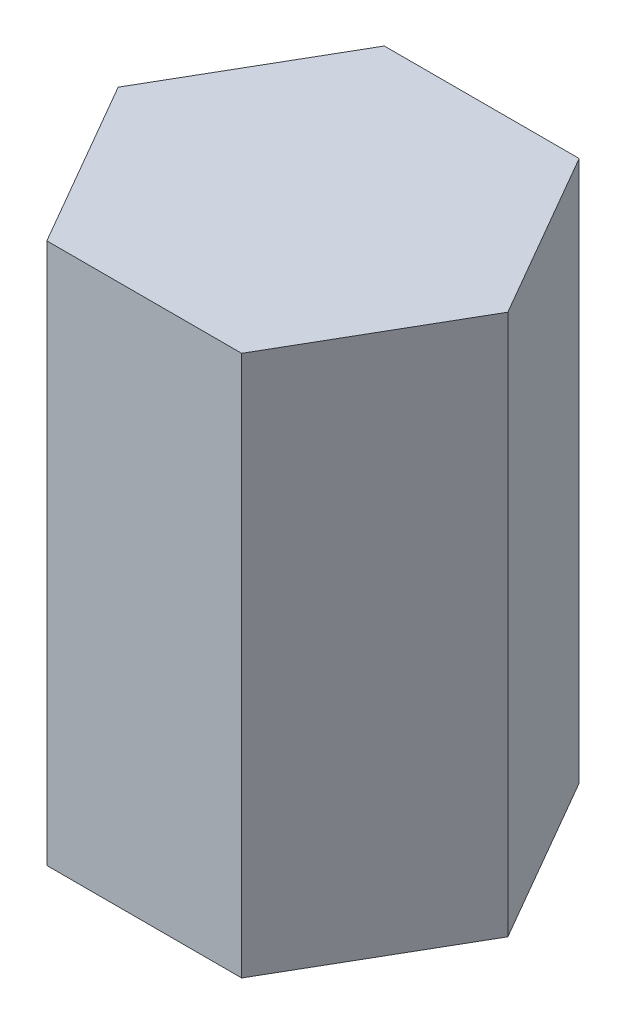
from build123d import *

# Parameters (mm, degrees)
BOSS_EXTRUDE1_DEPTH = 1603
CUT_EXTRUDE1_DEPTH  = 1187.25


with BuildPart() as part:
    # Sketch2 → Boss-Extrude1 (new body)
    with BuildSketch(Plane(origin=(0, 0, 0), x_dir=(1, 0, 0), z_dir=(0, 1, 0))):
        Polygon((577.35026919, 0), (288.675134595, 500), (-288.675134595, 500), (-577.35026919, 0), (-288.675134595, -500), (288.675134595, -500), align=None)
    extrude(amount=BOSS_EXTRUDE1_DEPTH)

    # Sketch3 → Cut-Extrude1 (cut)
    with BuildSketch(Plane(origin=(0, 400.75, 0), x_dir=(1, 0, 0), z_dir=(0, 1, 0))):
        Polygon((575.040868113, 0), (287.520434056, 498), (-287.520434056, 498), (-575.040868113, 0), (-287.520434056, -498), (287.520434056, -498), align=None)
    extrude(amount=CUT_EXTRUDE1_DEPTH, mode=Mode.SUBTRACT)


solid = part.part
